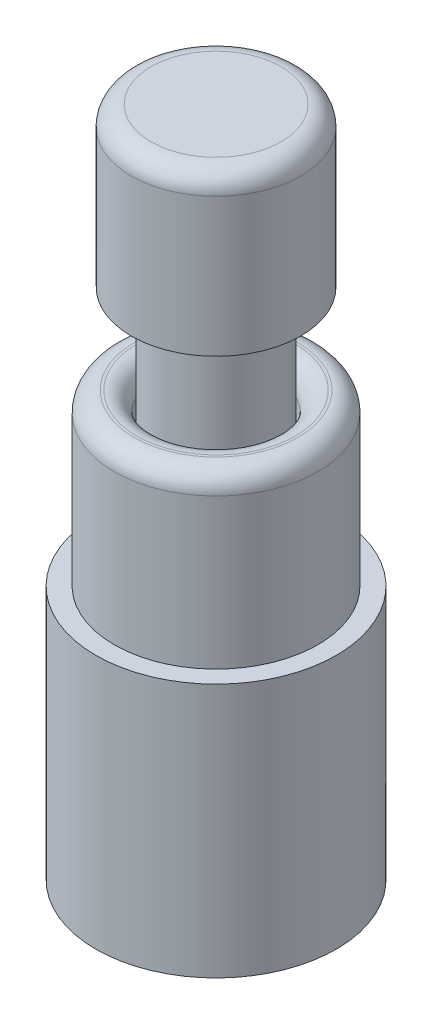
from build123d import *

# Parameters (mm, degrees)
SKETCH1_R           = 3.6
BOSS_EXTRUDE2_DEPTH = 6
SKETCH4_R           = 4.250000009
BOSS_EXTRUDE3_DEPTH = 9
SKETCH7_R           = 2.1082
CUT_EXTRUDE3_DEPTH  = 5.6
SKETCH5_R           = 2.000000064
BOSS_EXTRUDE6_DEPTH = 9.156
FILLET3_R           = 0.7
SKETCH9_R           = 3.000000096
BOSS_EXTRUDE7_DEPTH = 5.6
FILLET4_R           = 0.7


with BuildPart() as part:
    # Sketch1 → Boss-Extrude2 (new body)
    with BuildSketch(Plane(origin=(0, 0, 0), x_dir=(1, 0, 0), z_dir=(0, 1, 0))):
        with Locations(Location((0, 0, 0), (0, 0, 270))):
            Circle(SKETCH1_R)
    extrude(amount=BOSS_EXTRUDE2_DEPTH)

    # Sketch4 → Boss-Extrude3 (add)
    with BuildSketch(Plane(origin=(0, 0, 0), x_dir=(1, 0, 0), z_dir=(0, 1, 0))):
        with Locations(Location((0, 0, 0), (0, 0, 270))):
            Circle(SKETCH4_R)
    extrude(amount=-BOSS_EXTRUDE3_DEPTH)

    # Sketch7 → Cut-Extrude3 (cut)
    with BuildSketch(Plane(origin=(0, 6, 0), x_dir=(1, 0, 0), z_dir=(0, 1, 0))):
        with Locations(Location((0, 0, 0), (0, 0, 270))):
            Circle(SKETCH7_R)
    extrude(amount=-CUT_EXTRUDE3_DEPTH, mode=Mode.SUBTRACT)

    # Sketch5 → Boss-Extrude6 (add)
    with BuildSketch(Plane(origin=(0, 0, 0), x_dir=(1, 0, 0), z_dir=(0, 1, 0))):
        with Locations(Location((0, 0, 0), (0, 0, 270))):
            Circle(SKETCH5_R)
    extrude(amount=BOSS_EXTRUDE6_DEPTH)

    # Fillet3
    fillet3_edges = [part.edges().sort_by_distance(p)[0] for p in [
        (0, 6, -2.1082),
        (0, 6, -3.6),
    ]]
    fillet(fillet3_edges, radius=FILLET3_R)

    # Sketch9 → Boss-Extrude7 (add)
    with BuildSketch(Plane(origin=(0, 9.156, 0), x_dir=(1, 0, 0), z_dir=(0, 1, 0))):
        with Locations(Location((0, 0, 0), (0, 0, 270))):
            Circle(SKETCH9_R)
    extrude(amount=BOSS_EXTRUDE7_DEPTH)

    # Fillet4
    fillet4_edges = [part.edges().sort_by_distance(p)[0] for p in [
        (0, 14.756, -3.000000096),
    ]]
    fillet(fillet4_edges, radius=FILLET4_R)


solid = part.part
